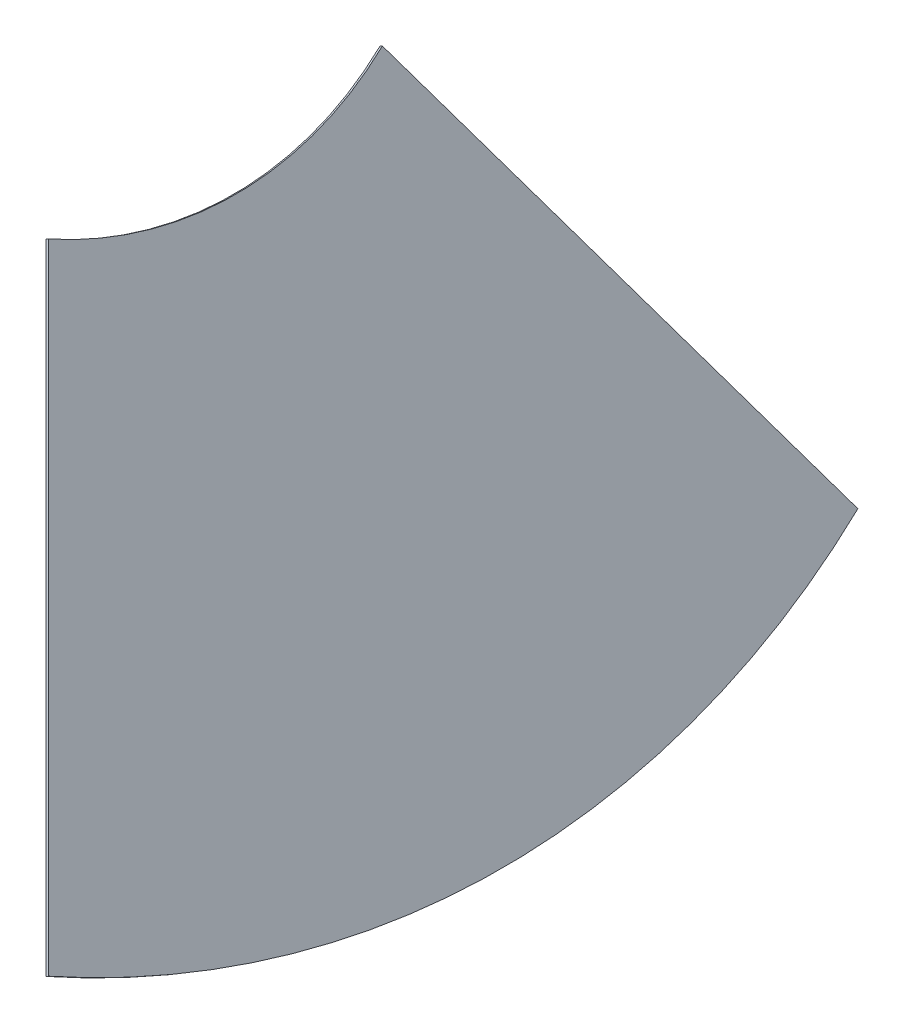
from build123d import *

# Parameters (mm, degrees)
BOSS_EXTRUDE1_DEPTH = 0.635


with BuildPart() as part:
    # Sketch2 → Boss-Extrude1 (new, symmetric)
    with BuildSketch(Plane(origin=(85.435748593, -57.39573825, -3.750805372), x_dir=(0.48497220665143115, -0.8173692926764732, 0.3109813469730999), z_dir=(-0.8600121206459059, -0.5102736053747359, 0))):
        with BuildLine():
            Line((-40.915798399, -59.96618862), (121.293079896, -223.040293463))
            ThreePointArc((121.293079896, -223.040293463), (217.33403322, -67.249933033), (232.034500869, 115.173742429))
            Line((232.034500869, 115.173742429), (4.802964729, 79.526682919))
            ThreePointArc((4.802964729, 79.526682919), (-1.271741781, 4.279072971), (-40.915798399, -59.96618862))
        make_face()
    extrude(amount=BOSS_EXTRUDE1_DEPTH, both=True)


solid = part.part
